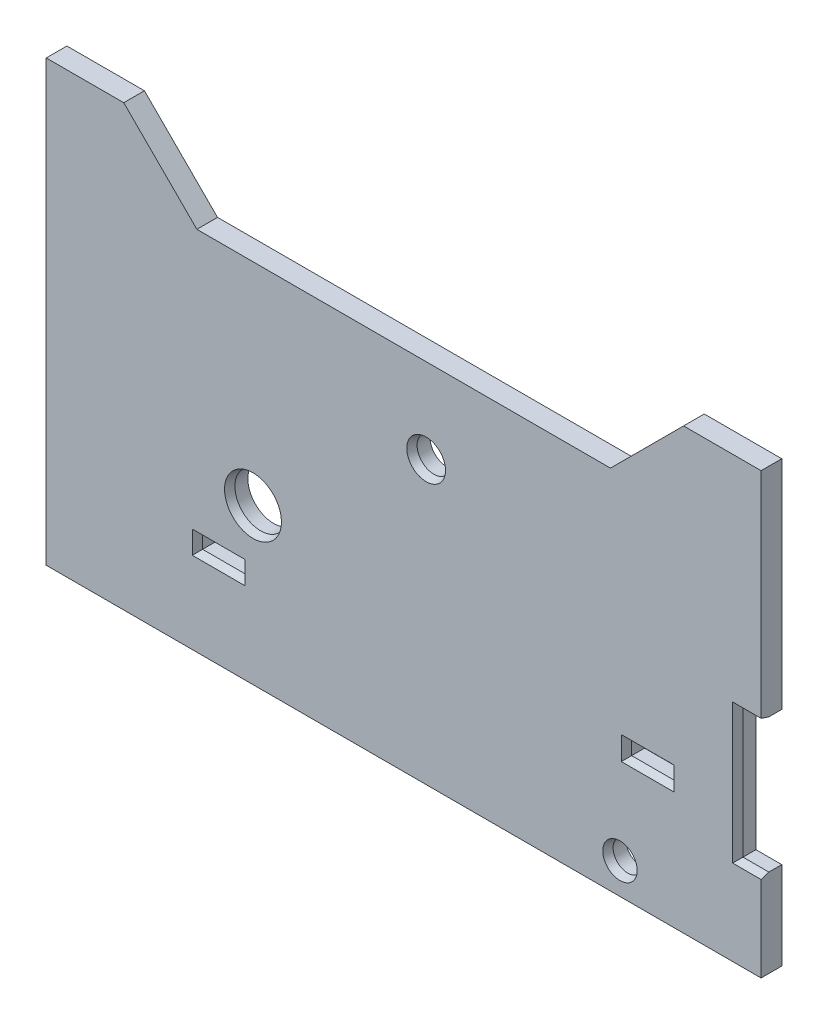
from build123d import *
from OCP.BRepFilletAPI import BRepFilletAPI_MakeChamfer

# Parameters (mm, degrees)
SKETCH1_R           = 5
SKETCH1_R_2         = 2.83
SKETCH1_R_3         = 3.25
SKETCH1_W           = 9.2
SKETCH1_H           = 3.53
SKETCH1_H_2         = 3.4
BOSS_EXTRUDE1_DEPTH = 2
BOSS_EXTRUDE2_DEPTH = 2
CHAMFER1_SIZE       = 0.5
CHAMFER1_SIZE2      = 1.5
CHAMFER2_SIZE       = 1.5
CHAMFER2_SIZE2      = 0.5


with BuildPart() as part:
    # Sketch1 → Boss-Extrude1 (new, symmetric)
    with BuildSketch(Plane.XY):
        Polygon((-86, -30), (-86, 30), (52.3, 30), (52.3, 13), (47.3, 13), (47.3, -13), (52.3, -13), (52.3, -30), align=None)
        with Locations((-46, 0)):
            Circle(SKETCH1_R, mode=Mode.SUBTRACT)
        with Locations((25, -24)):
            Circle(SKETCH1_R_2, mode=Mode.SUBTRACT)
        with Locations((-12.5, 24.5)):
            Circle(SKETCH1_R_3, mode=Mode.SUBTRACT)
        with Locations((30.35, -5)):
            Rectangle(SKETCH1_W, SKETCH1_H, mode=Mode.SUBTRACT)
        with Locations((-52.65, -12)):
            Rectangle(SKETCH1_W, SKETCH1_H_2, mode=Mode.SUBTRACT)
    extrude(amount=BOSS_EXTRUDE1_DEPTH, both=True)

    # Sketch2 → Boss-Extrude2 (add, symmetric)
    with BuildSketch(Plane.XY):
        Polygon((-86, 30), (52.3, 30), (52.3, 55), (37.3, 55), (23.157864376, 40.857864376), (-56.857864376, 40.857864376), (-71, 55), (-86, 55), align=None)
    extrude(amount=BOSS_EXTRUDE2_DEPTH, both=True)

    # Chamfer1
    chamfer1_edges = [part.edges().sort_by_distance(p)[0] for p in [
        (-57.25, -12, 2),
        (-52.65, -13.7, 2),
        (-48.05, -12, 2),
        (-52.65, -10.3, 2),
        (-15.75, 24.5, 2),
        (-51, 0, 2),
        (25.75, -5, 2),
        (30.35, -6.765, 2),
        (34.95, -5, 2),
        (30.35, -3.235, 2),
        (22.17, -24, 2),
    ]]
    chamfer1_side = [part.faces().sort_by_distance(p)[0] for p in [
        (-17.641163969, 8.221234178, 2),
    ]]
    chamfer(chamfer1_edges, length=CHAMFER1_SIZE, length2=CHAMFER1_SIZE2, reference=chamfer1_side[0])

    # Chamfer2: one chamfer whose edges measure the first distance from different faces: ONE call of the kernel's chamfer builder (chamfer() names one face for all edges)
    chamfer2_edges_1 = [part.edges().sort_by_distance(p)[0] for p in [
        (49.8, -13, 2),
    ]]
    chamfer2_side_1 = [part.faces().sort_by_distance(p)[0] for p in [
        (49.8, -13, 0),
    ]]
    chamfer2_edges_2 = [part.edges().sort_by_distance(p)[0] for p in [
        (47.3, 0, 2),
    ]]
    chamfer2_side_2 = [part.faces().sort_by_distance(p)[0] for p in [
        (47.3, 0, 0),
    ]]
    chamfer2_edges_3 = [part.edges().sort_by_distance(p)[0] for p in [
        (49.8, 13, 2),
    ]]
    chamfer2_side_3 = [part.faces().sort_by_distance(p)[0] for p in [
        (49.8, 13, 0),
    ]]
    chamfer2 = BRepFilletAPI_MakeChamfer(part.part.solid().wrapped)
    for e in chamfer2_edges_1:
        chamfer2.Add(CHAMFER2_SIZE, CHAMFER2_SIZE2, e.wrapped, chamfer2_side_1[0].wrapped)  # the first distance lies on this face
    for e in chamfer2_edges_2:
        chamfer2.Add(CHAMFER2_SIZE, CHAMFER2_SIZE2, e.wrapped, chamfer2_side_2[0].wrapped)  # the first distance lies on this face
    for e in chamfer2_edges_3:
        chamfer2.Add(CHAMFER2_SIZE, CHAMFER2_SIZE2, e.wrapped, chamfer2_side_3[0].wrapped)  # the first distance lies on this face
    add(Compound.cast(chamfer2.Shape()), mode=Mode.REPLACE)


solid = part.part
